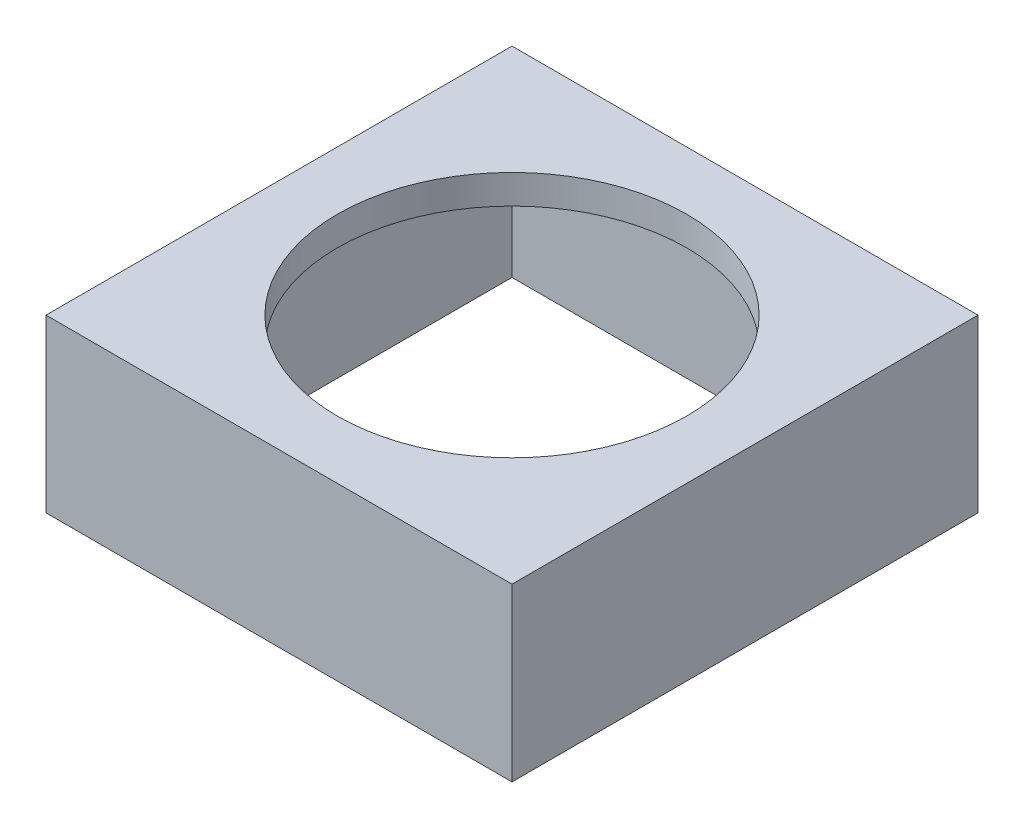
from build123d import *

# Parameters (mm, degrees)
SKETCH1_W           = 8
SKETCH1_H           = 8
SKETCH1_W_2         = 7
SKETCH1_H_2         = 7
BOSS_EXTRUDE1_DEPTH = 2.94
SKETCH2_W           = 8
SKETCH2_H           = 8
SKETCH2_R           = 3
BOSS_EXTRUDE2_DEPTH = 0.5


with BuildPart() as part:
    # Sketch1 → Boss-Extrude1 (new body)
    with BuildSketch(Plane(origin=(0, 0, 0), x_dir=(1, 0, 0), z_dir=(0, 1, 0))):
        Rectangle(SKETCH1_W, SKETCH1_H)
        Rectangle(SKETCH1_W_2, SKETCH1_H_2, mode=Mode.SUBTRACT)
    extrude(amount=BOSS_EXTRUDE1_DEPTH)

    # Sketch2 → Boss-Extrude2 (add)
    with BuildSketch(Plane(origin=(0, 2.94, 0), x_dir=(1, 0, 0), z_dir=(0, 1, 0))):
        Rectangle(SKETCH2_W, SKETCH2_H)
        with Locations(Location((0, 0, 0), (0, 0, 270))):
            Circle(SKETCH2_R, mode=Mode.SUBTRACT)
    extrude(amount=-BOSS_EXTRUDE2_DEPTH)


solid = part.part
